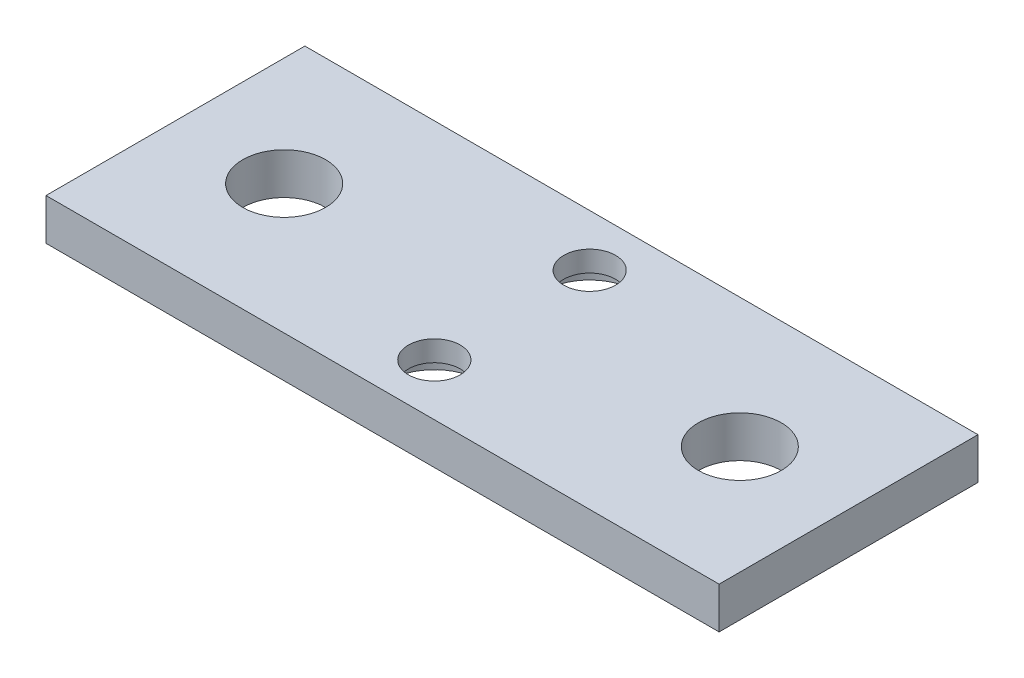
from build123d import *

# Parameters (mm, degrees)
SKETCH_1_W          = 65
SKETCH_1_H          = 25
EXTRUDE_1_DEPTH     = 4
SKETCH_2_W          = 15
SKETCH_2_H          = 25
EXTRUDE_2_DEPTH     = 13
SKETCH_3_R          = 2.5
SKETCH_3_R_2        = 4
CUT_EXTRUDE_1_DEPTH = 39.74919354
SKETCH_4_R          = 4.5
CUT_EXTRUDE_2_DEPTH = 2
SKETCH_5_W          = 15
SKETCH_5_H          = 4
EXTRUDE_3_DEPTH     = 6
SKETCH_6_R          = 1.25
CUT_EXTRUDE_3_DEPTH = 40.59166579
FILLET_2_R          = 3
SKETCH_9_W          = 15
SKETCH_9_H          = 13
CUT_EXTRUDE_4_DEPTH = 53.098464469


with BuildPart() as part:
    # 草图1 → 凸台-拉伸1 (new body)
    with BuildSketch(Plane(origin=(0, 0, 0), x_dir=(1, 0, 0), z_dir=(0, 1, 0))):
        Rectangle(SKETCH_1_W, SKETCH_1_H)
    extrude(amount=EXTRUDE_1_DEPTH)

    # 草图2 → 凸台-拉伸2 (add)
    with BuildSketch(Plane(origin=(0, 4, 0), x_dir=(1, 0, 0), z_dir=(0, 1, 0))):
        Rectangle(SKETCH_2_W, SKETCH_2_H)
    extrude(amount=EXTRUDE_2_DEPTH)

    # 草图3 → 切除-拉伸1 (cut, through all)
    with BuildSketch(Plane.XZ):
        with Locations(Location((0, -7.5, 0), (0, 0, 270))):
            Circle(SKETCH_3_R)
        with Locations(Location((0, 7.5, 0), (0, 0, 90))):
            Circle(SKETCH_3_R)
        with Locations(Location((-22, 0, 0), (0, 0, 270))):
            Circle(SKETCH_3_R_2)
        with Locations(Location((22, 0, 0), (0, 0, 90))):
            Circle(SKETCH_3_R_2)
    extrude(amount=-CUT_EXTRUDE_1_DEPTH, mode=Mode.SUBTRACT)

    # 草图4 → 切除-拉伸2 (cut)
    with BuildSketch(Plane.XZ):
        with Locations(Location((0, -7.5, 0), (0, 0, 270))):
            Circle(SKETCH_4_R)
        with Locations(Location((0, 7.5, 0), (0, 0, 270))):
            Circle(SKETCH_4_R)
    extrude(amount=-CUT_EXTRUDE_2_DEPTH, mode=Mode.SUBTRACT)

    # 草图5 → 凸台-拉伸3 (add)
    with BuildSketch(Plane.XY.offset(12.5)):
        with Locations((0, 6)):
            Rectangle(SKETCH_5_W, SKETCH_5_H)
    extrude_3 = extrude(amount=EXTRUDE_3_DEPTH)

    # 草图6 → 切除-拉伸3 (cut, through all)
    with BuildSketch(Plane.XZ.offset(-4)):
        with Locations(Location((-4.5, 15.5, 0), (0, 0, 270))):
            Circle(SKETCH_6_R)
        with Locations(Location((4.5, 15.5, 0), (0, 0, 270))):
            Circle(SKETCH_6_R)
    cut_extrude_3 = extrude(amount=-CUT_EXTRUDE_3_DEPTH, mode=Mode.SUBTRACT)

    # 镜向2: 凸台-拉伸3, 切除-拉伸3 across plane
    add(extrude_3.mirror(Plane.XY))
    add(cut_extrude_3.mirror(Plane.XY), mode=Mode.SUBTRACT)

    # 圆角2
    fillet_2_edges = [part.edges().sort_by_distance(p)[0] for p in [
        (-7.5, 6, 18.5),
        (7.5, 6, 18.5),
        (-7.5, 6, -18.5),
        (7.5, 6, -18.5),
    ]]
    fillet(fillet_2_edges, radius=FILLET_2_R)

    # 草图9 → 切除-拉伸4 (cut, through all)
    with BuildSketch(Plane.XY.offset(18.5)):
        with Locations((0, 10.5)):
            Rectangle(SKETCH_9_W, SKETCH_9_H)
    extrude(amount=-CUT_EXTRUDE_4_DEPTH, mode=Mode.SUBTRACT)


solid = part.part
